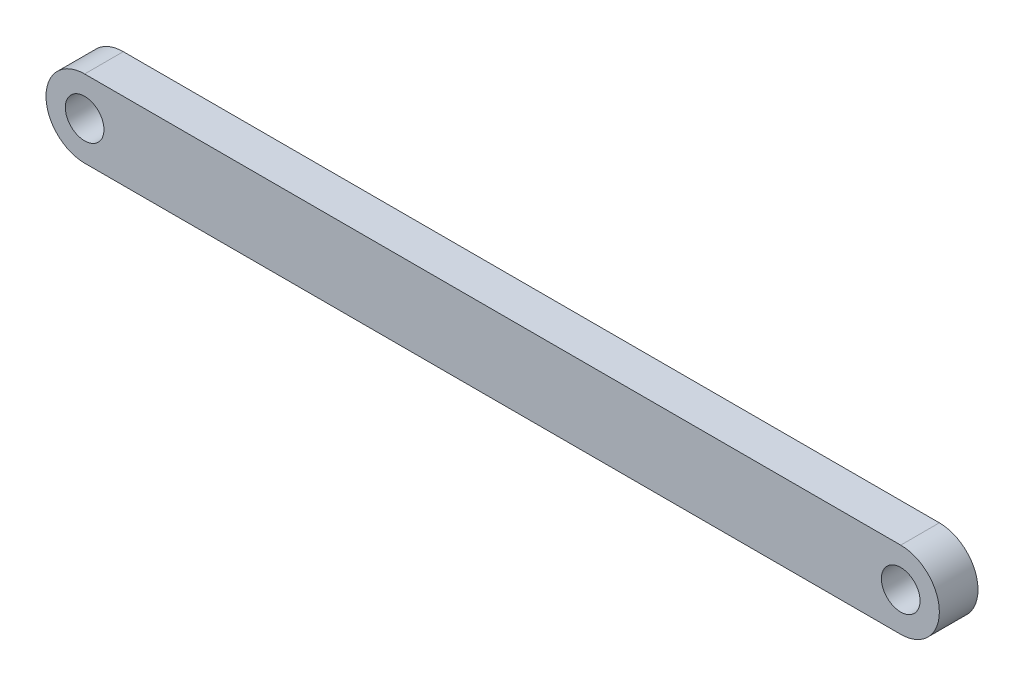
from build123d import *

# Parameters (mm, degrees)
SKETCH_1_R      = 1
EXTRUDE_1_DEPTH = 2


with BuildPart() as part:
    # 草圖1 → 填料-伸長1 (new body)
    with BuildSketch(Plane.XY):
        with BuildLine():
            Line((-21.119999972, 2.00108974), (21.120000028, 2.00108974))
            ThreePointArc((21.120000028, 2.00108974), (23.120000028, 0.00108974), (21.120000028, -1.99891026))
            Line((21.120000028, -1.99891026), (-21.119999972, -1.99891026))
            ThreePointArc((-21.119999972, -1.99891026), (-23.119999972, 0.00108974), (-21.119999972, 2.00108974))
        make_face()
        with Locations((-21.119999972, 0.00108974)):
            Circle(SKETCH_1_R, mode=Mode.SUBTRACT)
        with Locations((21.120000028, 0.00108974)):
            Circle(SKETCH_1_R, mode=Mode.SUBTRACT)
    extrude(amount=EXTRUDE_1_DEPTH)


solid = part.part
